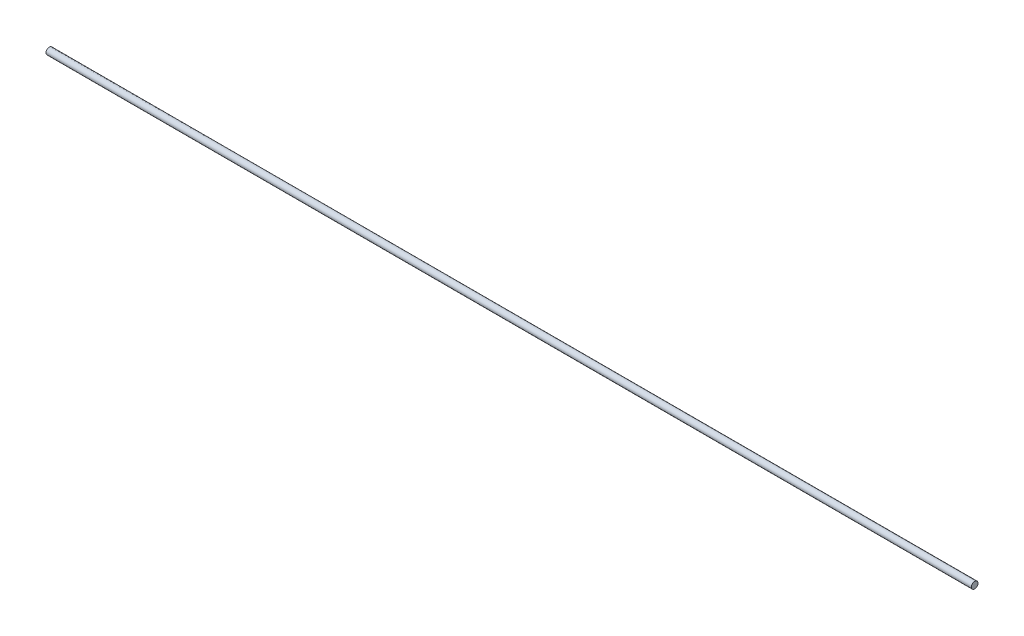
from build123d import *

# Parameters (mm, degrees)
SKETCH1_W = 140
SKETCH1_H = 0.5


with BuildPart() as part:
    # Sketch1 → Revolve1 (revolve)
    with BuildSketch(Plane.XY, mode=Mode.PRIVATE) as revolve1_sk:
        with Locations((70, 0.25)):
            Rectangle(SKETCH1_W, SKETCH1_H)
    revolve(revolve1_sk.sketch.rotate(Axis((0, 0, 0), (1, 0, 0)), 90), axis=Axis((0, 0, 0), (1, 0, 0)))


solid = part.part
